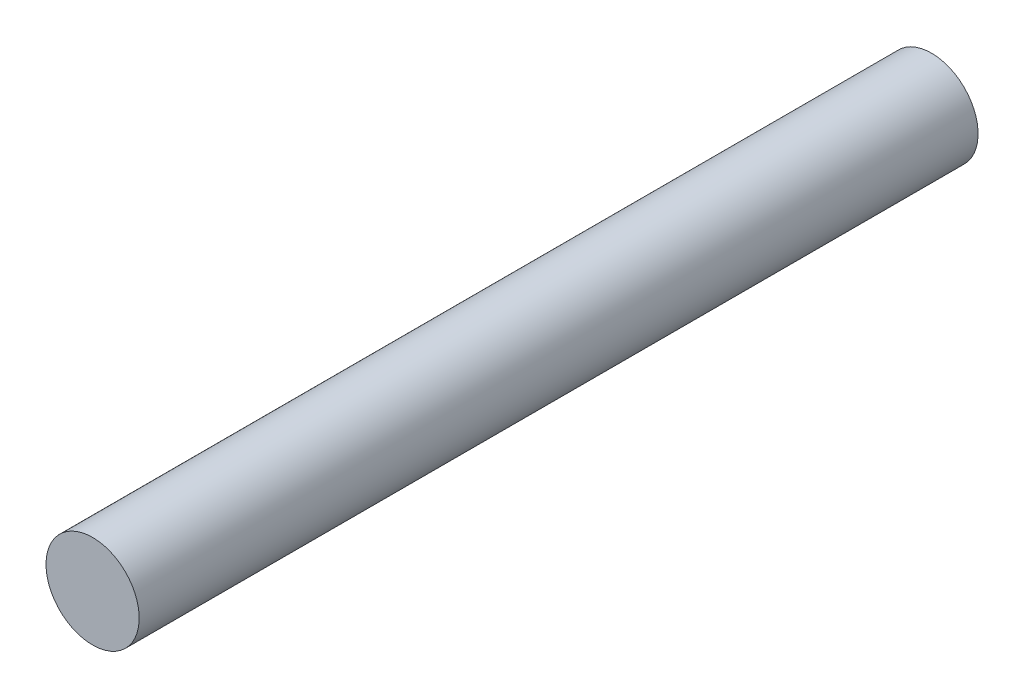
from build123d import *

# Parameters (mm, degrees)
SKETCH2_R           = 2.5
BOSS_EXTRUDE1_DEPTH = 45


with BuildPart() as part:
    # Sketch2 → Boss-Extrude1 (new body)
    with BuildSketch(Plane.XY):
        with Locations(Location((3.125649083, 22.553272892, 0), (0, 0, 180))):
            Circle(SKETCH2_R)
    extrude(amount=BOSS_EXTRUDE1_DEPTH)


solid = part.part
